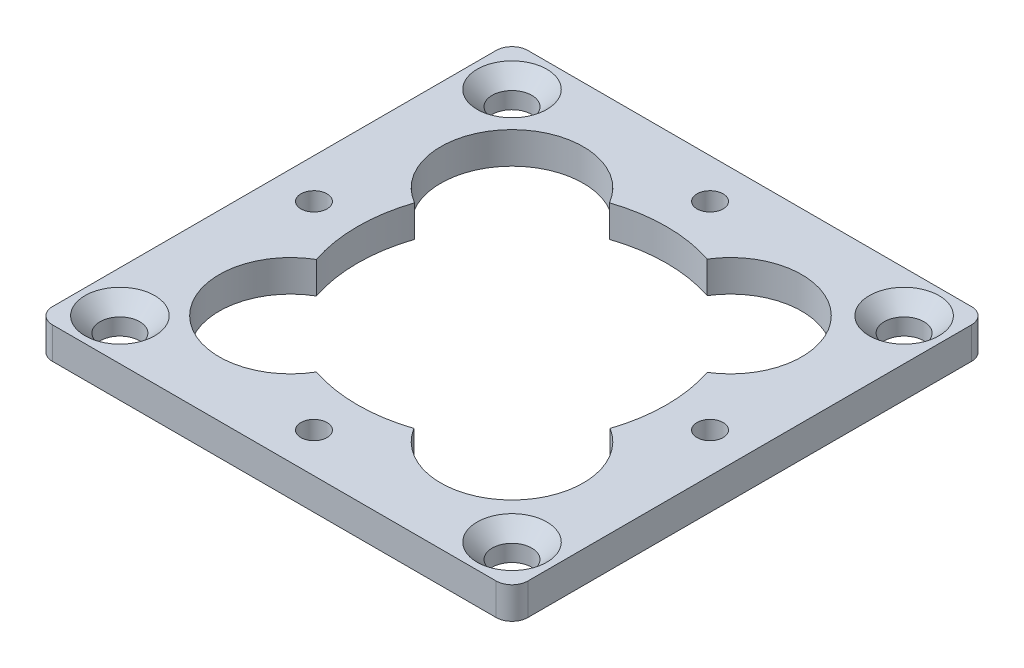
from build123d import *

# Parameters (mm, degrees)
SKETCH_1_W      = 60
SKETCH_1_H      = 60
SKETCH_1_R      = 2.5
SKETCH_1_R_2    = 1.65
EXTRUDE_1_DEPTH = 4
FILLET_1_R      = 2
CHAMFER_1_SIZE  = 1.9


with BuildPart() as part:
    # Эскиз1 → Бобышка-Вытянуть1 (new body)
    with BuildSketch(Plane(origin=(0, 0, 0), x_dir=(1, 0, 0), z_dir=(0, 1, 0))):
        with Locations((-8.705299467, 3.781032797)):
            Rectangle(SKETCH_1_W, SKETCH_1_H)
        with Locations(Location((-33.454036809, 28.529770139, 0), (0, 0, 270))):
            Circle(SKETCH_1_R, mode=Mode.SUBTRACT)
        with Locations(Location((16.043437874, 28.529770139, 0), (0, 0, 270))):
            Circle(SKETCH_1_R, mode=Mode.SUBTRACT)
        with Locations(Location((-33.454036809, -20.967704544, 0), (0, 0, 270))):
            Circle(SKETCH_1_R, mode=Mode.SUBTRACT)
        with Locations(Location((16.043437874, -20.967704544, 0), (0, 0, 270))):
            Circle(SKETCH_1_R, mode=Mode.SUBTRACT)
        with Locations(Location((-33.705299467, 3.781032797, 0), (0, 0, 270))):
            Circle(SKETCH_1_R_2, mode=Mode.SUBTRACT)
        with Locations(Location((16.294700533, 3.781032797, 0), (0, 0, 270))):
            Circle(SKETCH_1_R_2, mode=Mode.SUBTRACT)
        with Locations(Location((-8.705299467, 28.781032797, 0), (0, 0, 270))):
            Circle(SKETCH_1_R_2, mode=Mode.SUBTRACT)
        with Locations(Location((-8.705299467, -21.218967203, 0), (0, 0, 270))):
            Circle(SKETCH_1_R_2, mode=Mode.SUBTRACT)
        with BuildLine():
            ThreePointArc((-27.195682571, 9.974233316), (-28.205299467, 3.781032797), (-27.195682571, -2.412167721))
            ThreePointArc((-27.195682571, -2.412167721), (-29.05264456, -16.566312295), (-14.898499986, -14.709350307))
            ThreePointArc((-14.898499986, -14.709350307), (-8.739771419, -15.718936733), (-2.577511871, -14.731131289))
            ThreePointArc((-2.577511871, -14.731131289), (11.447243796, -16.371510466), (9.806864619, -2.346754799))
            ThreePointArc((9.806864619, -2.346754799), (10.794700533, 3.781032797), (9.806864619, 9.908820393))
            ThreePointArc((9.806864619, 9.908820393), (11.447243796, 23.933576061), (-2.577511871, 22.293196884))
            ThreePointArc((-2.577511871, 22.293196884), (-8.739771419, 23.281002328), (-14.898499986, 22.271415901))
            ThreePointArc((-14.898499986, 22.271415901), (-29.05264456, 24.12837789), (-27.195682571, 9.974233316))
        make_face(mode=Mode.SUBTRACT)
    extrude(amount=EXTRUDE_1_DEPTH)

    # Скругление1
    fillet_1_edges = [part.edges().sort_by_distance(p)[0] for p in [
        (-38.705299467, 2, -33.781032797),
        (21.294700533, 2, -33.781032797),
        (21.294700533, 2, 26.218967203),
        (-38.705299467, 2, 26.218967203),
    ]]
    fillet(fillet_1_edges, radius=FILLET_1_R)

    # Фаска1
    chamfer_1_edges = [part.edges().sort_by_distance(p)[0] for p in [
        (-33.454036809, 4, -31.029770139),
        (16.043437874, 4, -31.029770139),
        (-33.454036809, 4, 18.467704544),
        (16.043437874, 4, 18.467704544),
    ]]
    chamfer(chamfer_1_edges, length=CHAMFER_1_SIZE)


solid = part.part
